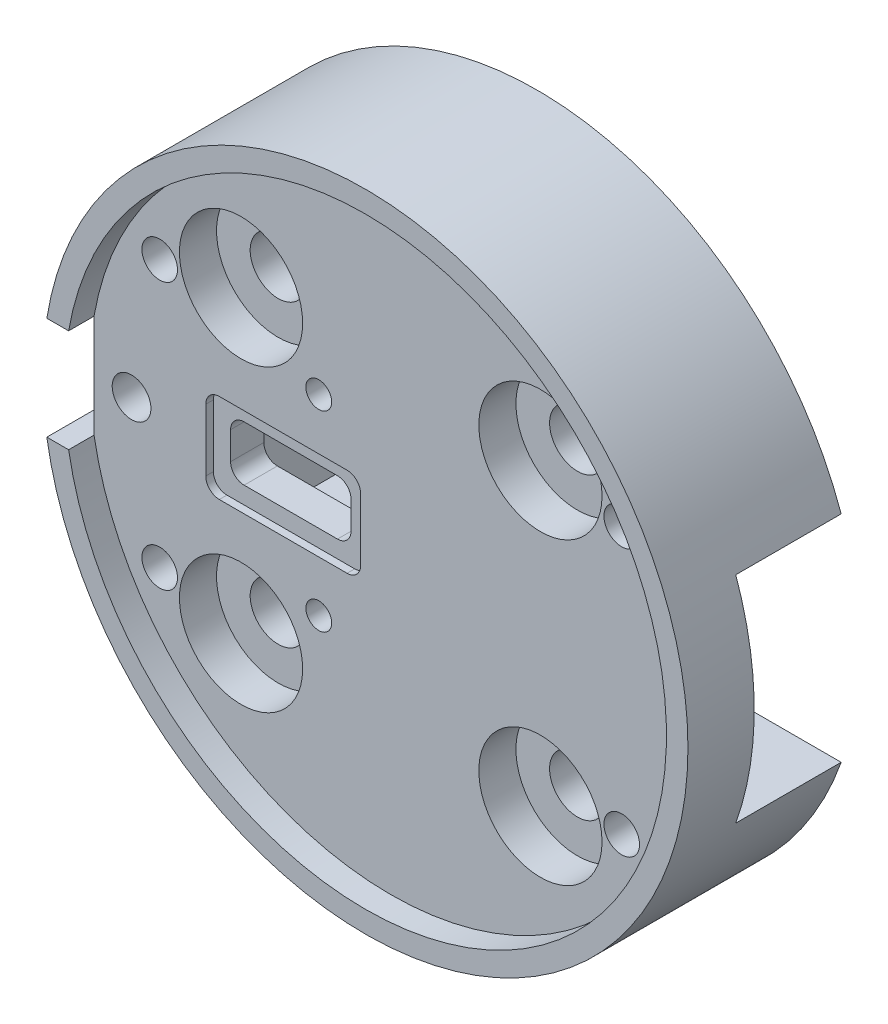
from build123d import *

# Parameters (mm, degrees)
SKETCH1_R                               = 38.1
BOSS_EXTRUDE1_DEPTH                     = 17.272
CBORE_FOR_M6_HEX_HEAD_BOLT1_D           = 6.6
CBORE_FOR_M6_HEX_HEAD_BOLT1_CBORE_D     = 14.55
CBORE_FOR_M6_HEX_HEAD_BOLT1_CBORE_DEPTH = 4.38
SKETCH6_R                               = 1.515
PIN_FOR_M6_DEPTH                        = 17.272
M5X0_8_TAPPED_HOLE1_D                   = 4.2
SKETCH10_R                              = 1.05
SPRING_PIN_HOLE_DEPTH                   = 17.272
ALLIGNMENT_BORDER_DEPTH                 = 3
CUT_EXTRUDE2_DEPTH                      = 0.9
SKETCH16_R                              = 2.286
R_PIN_GROUNDING_DEPTH                   = 4.318
CUT_EXTRUDE3_START                      = -12.446
CUT_EXTRUDE3_DEPTH                      = 12.446
SKETCH18_W                              = 4.238089583
SKETCH18_H                              = 12.155953692
CUT_EXTRUDE4_DEPTH                      = 5.08
BOSS_EXTRUDE2_START                     = -17.272
SKETCH19_R                              = 1.515
BOSS_EXTRUDE2_DEPTH                     = 17.272
SKETCH20_R                              = 1.524
CUT_EXTRUDE5_DEPTH                      = 5.08


with BuildPart() as part:
    # Sketch1 → Boss-Extrude1 (new body)
    with BuildSketch(Plane.XY):
        Circle(SKETCH1_R)
    extrude(amount=BOSS_EXTRUDE1_DEPTH)

    # CBORE for M6 Hex Head Bolt1 (through all)
    with Locations(Plane.XY.offset(17.272)):
        with Locations((17.67766953, 17.67766953), (17.67766953, -17.67766953), (-17.67766953, -17.67766953), (-17.67766953, 17.67766953)):
            CounterBoreHole(CBORE_FOR_M6_HEX_HEAD_BOLT1_D / 2, CBORE_FOR_M6_HEX_HEAD_BOLT1_CBORE_D / 2, CBORE_FOR_M6_HEX_HEAD_BOLT1_CBORE_DEPTH)

    # Sketch6 → Pin_for_M6 (cut)
    with BuildSketch(Plane.XY.offset(17.272)):
        with Locations((-5.653014274, 24.676900213)):
            Circle(SKETCH6_R)
    extrude(amount=-PIN_FOR_M6_DEPTH, mode=Mode.SUBTRACT)

    # M5x0.8 Tapped Hole1 (through all)
    with Locations(Plane.XY.offset(17.272)):
        with Locations((27.279800219, 15.75), (-27.279800219, 15.75), (27.279800219, -15.75), (-27.279800219, -15.75)):
            Hole(M5X0_8_TAPPED_HOLE1_D / 2)

    # Sketch10 → Spring_Pin_Hole (cut)
    with BuildSketch(Plane.XY.offset(17.272)):
        with Locations((-5.653014274, 24.676900213)):
            Circle(SKETCH10_R)
        with BuildLine():
            Line((-18.212, 3.2385), (-7.188, 3.2385))
            ThreePointArc((-7.188, 3.2385), (-6.05662915, 2.76987085), (-5.588, 1.6385))
            Line((-5.588, 1.6385), (-5.588, -1.6385))
            ThreePointArc((-5.588, -1.6385), (-6.05662915, -2.76987085), (-7.188, -3.2385))
            Line((-7.188, -3.2385), (-18.212, -3.2385))
            ThreePointArc((-18.212, -3.2385), (-19.34337085, -2.76987085), (-19.812, -1.6385))
            Line((-19.812, -1.6385), (-19.812, 1.6385))
            ThreePointArc((-19.812, 1.6385), (-19.34337085, 2.76987085), (-18.212, 3.2385))
        make_face()
    extrude(amount=-SPRING_PIN_HOLE_DEPTH, mode=Mode.SUBTRACT)

    # Sketch13 → Allignment_Border (add)
    with BuildSketch(Plane.XY.offset(17.272)):
        with BuildLine():
            Line((-37.612075155, 6.077976846), (-35.036720701, 6.077976846))
            ThreePointArc((-35.036720701, 6.077976846), (0.151738272, 35.559676257), (35.087315055, 5.778747461))
            ThreePointArc((35.087315055, 5.778747461), (5.928416127, -35.06233709), (-35.036720701, -6.077976846))
            Line((-35.036720701, -6.077976846), (-37.612075155, -6.077976846))
            ThreePointArc((-37.612075155, -6.077976846), (0.15158135, -38.099698465), (37.659246703, -5.778506535))
            ThreePointArc((37.659246703, -5.778506535), (5.928288609, 37.635958792), (-37.612075155, 6.077976846))
        make_face()
    extrude(amount=ALLIGNMENT_BORDER_DEPTH)

    # Sketch15 → Cut-Extrude2 (cut)
    with BuildSketch(Plane.XY.offset(17.272)):
        with BuildLine():
            Line((-20.244, 5.2705), (-5.156, 5.2705))
            ThreePointArc((-5.156, 5.2705), (-4.02462915, 4.80187085), (-3.556, 3.6705))
            Line((-3.556, 3.6705), (-3.556, -3.6705))
            ThreePointArc((-3.556, -3.6705), (-4.02462915, -4.80187085), (-5.156, -5.2705))
            Line((-5.156, -5.2705), (-20.244, -5.2705))
            ThreePointArc((-20.244, -5.2705), (-21.37537085, -4.80187085), (-21.844, -3.6705))
            Line((-21.844, -3.6705), (-21.844, 3.6705))
            ThreePointArc((-21.844, 3.6705), (-21.37537085, 4.80187085), (-20.244, 5.2705))
        make_face()
    extrude(amount=-CUT_EXTRUDE2_DEPTH, mode=Mode.SUBTRACT)

    # Sketch16 → R_Pin_Grounding (cut)
    with BuildSketch(Plane.XY.offset(17.272)):
        with Locations((-30.607, 0)):
            Circle(SKETCH16_R)
    extrude(amount=-R_PIN_GROUNDING_DEPTH, mode=Mode.SUBTRACT)

    # Sketch17 → Cut-Extrude3 (cut)
    with BuildSketch(Plane(origin=(0, 0, 0), x_dir=(-1, 0, 0), z_dir=(0, 0, -1)).offset(CUT_EXTRUDE3_START)):
        with BuildLine():
            Line((-11.43, 12.7), (-35.921024484, 12.7))
            ThreePointArc((-35.921024484, 12.7), (-38.1, 0), (-35.921024484, -12.7))
            Line((-35.921024484, -12.7), (-11.43, -12.7))
            Line((-11.43, -12.7), (-11.43, -19.908773642))
            Line((-11.43, -19.908773642), (11.43, -19.908773642))
            Line((11.43, -19.908773642), (11.43, -12.7))
            Line((11.43, -12.7), (23.368, -12.7))
            Line((23.368, -12.7), (23.368, 12.7))
            Line((23.368, 12.7), (11.43, 12.7))
            Line((11.43, 12.7), (11.43, 19.967789095))
            Line((11.43, 19.967789095), (-11.43, 19.967789095))
            Line((-11.43, 19.967789095), (-11.43, 12.7))
        make_face()
        with BuildLine():
            ThreePointArc((7.188, -3.2385), (6.05662915, -2.76987085), (5.588, -1.6385))
            Line((5.588, -1.6385), (5.588, 1.6385))
            ThreePointArc((5.588, 1.6385), (6.05662915, 2.76987085), (7.188, 3.2385))
            Line((7.188, 3.2385), (18.212, 3.2385))
            ThreePointArc((18.212, 3.2385), (19.34337085, 2.76987085), (19.812, 1.6385))
            Line((19.812, 1.6385), (19.812, -1.6385))
            ThreePointArc((19.812, -1.6385), (19.34337085, -2.76987085), (18.212, -3.2385))
            Line((18.212, -3.2385), (7.188, -3.2385))
        make_face(mode=Mode.SUBTRACT)
    extrude(amount=CUT_EXTRUDE3_DEPTH, mode=Mode.SUBTRACT)

    # Sketch18 → Cut-Extrude4 (cut)
    with BuildSketch(Plane.XY.offset(17.272)):
        with Locations((-37.155765493, 0)):
            Rectangle(SKETCH18_W, SKETCH18_H)
    extrude(amount=-CUT_EXTRUDE4_DEPTH, mode=Mode.SUBTRACT)

    # Sketch19 → Boss-Extrude2 (add)
    with BuildSketch(Plane(origin=(0, 0, 0), x_dir=(-1, 0, 0), z_dir=(0, 0, -1)).offset(BOSS_EXTRUDE2_START)):
        with Locations((5.653014274, 24.676900213)):
            Circle(SKETCH19_R)
    extrude(amount=BOSS_EXTRUDE2_DEPTH)

    # Sketch20 → Cut-Extrude5 (cut)
    with BuildSketch(Plane(origin=(0, 0, 12.446), x_dir=(-1, 0, 0), z_dir=(0, 0, -1))):
        with Locations((8.49829012, -11.272773642)):
            Circle(SKETCH20_R)
        with Locations((8.49829012, 11.331789095)):
            Circle(SKETCH20_R)
    extrude(amount=-CUT_EXTRUDE5_DEPTH, mode=Mode.SUBTRACT)


solid = part.part
